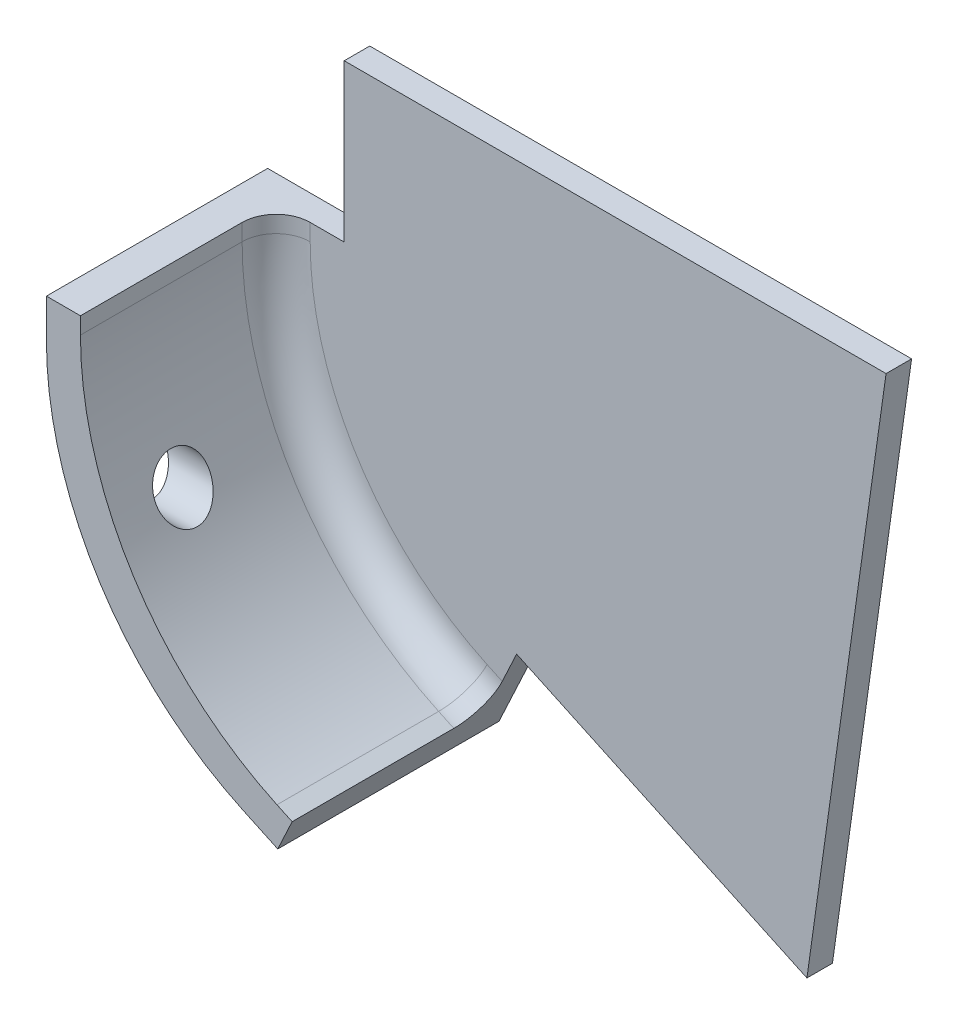
from build123d import *

# Parameters (mm, degrees)
BOSS_EXTRUDE1_DEPTH = 1.5
BOSS_EXTRUDE2_DEPTH = 13
CUT_EXTRUDE3_DEPTH  = 11.5
FILLET7_R           = 20
FILLET8_R           = 2
SKETCH5_R           = 1.6
CUT_EXTRUDE4_DEPTH  = 5.75


with BuildPart() as part:
    # Sketch1 → Boss-Extrude1 (new body)
    with BuildSketch(Plane.XY):
        Polygon((-4.481783153, -31.006256204), (9.112833652, -37.34553013), (13.762412955, -4.262054337), (-18.076399959, -4.262054337), (-18.076399959, -9.666982278), (-18.076399959, -24.666982278), align=None)
    extrude(amount=BOSS_EXTRUDE1_DEPTH)

    # Sketch2 → Boss-Extrude2 (add)
    with BuildSketch(Plane(origin=(0, 0, 0), x_dir=(-1, 0, 0), z_dir=(0, 0, -1))):
        Polygon((24.076399959, -28.489403843), (24.076399959, -13.489403843), (17.076399959, -13.489403843), (17.076399959, -24.029912017), (7.523455321, -28.48452326), (10.481783153, -34.828677769), align=None)
    extrude(amount=-BOSS_EXTRUDE2_DEPTH)

    # Sketch4 → Cut-Extrude3 (cut)
    with BuildSketch(Plane.XY.offset(13)):
        Polygon((-17.076399959, -13.489403843), (-22.076399959, -13.489403843), (-22.076399959, -27.215263321), (-9.63654663, -33.016062195), (-7.523455321, -28.48452326), (-17.076399959, -24.029912017), align=None)
    extrude(amount=-CUT_EXTRUDE3_DEPTH, mode=Mode.SUBTRACT)

    # Fillet7
    fillet7_edges = [part.edges().sort_by_distance(p)[0] for p in [
        (-24.076399959, -28.489403843, 6.5),
        (-22.076399959, -27.215263321, 7.25),
    ]]
    fillet(fillet7_edges, radius=FILLET7_R)

    # Fillet8
    fillet8_edges = [part.edges().sort_by_distance(p)[0] for p in [
        (-22.076399959, -13.981630974, 1.5),
        (-10.082655912, -32.808038021, 1.5),
        (-18.944228875, -25.219850272, 1.5),
    ]]
    fillet(fillet8_edges, radius=FILLET8_R)

    # Sketch5 → Cut-Extrude4 (cut, symmetric)
    with BuildSketch(Plane(origin=(-22.076399959, 0, 0), x_dir=(0, 0, -1), z_dir=(1, 0, 0))):
        with Locations(Location((-9, -23.189403843, 0), (0, 0, 90))):
            Circle(SKETCH5_R)
    extrude(amount=CUT_EXTRUDE4_DEPTH, both=True, mode=Mode.SUBTRACT)


solid = part.part
